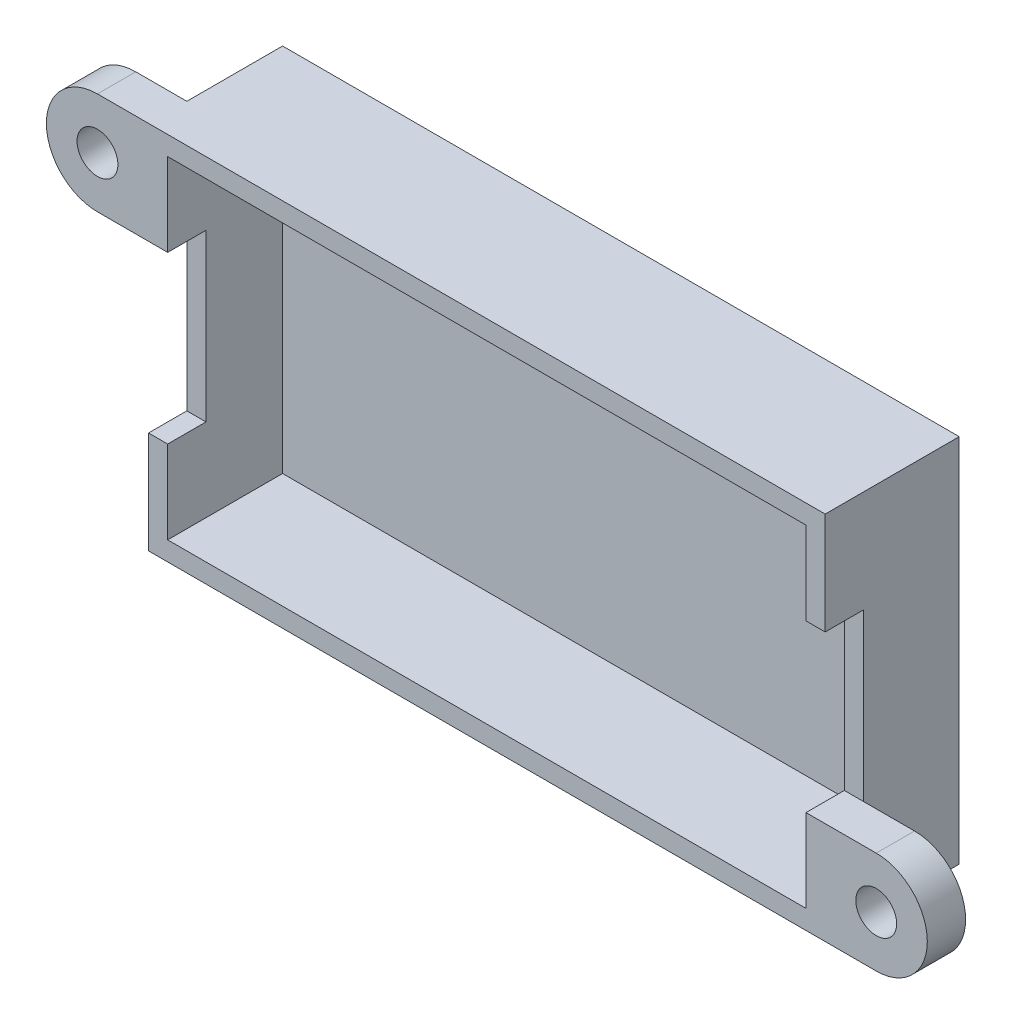
from build123d import *

# Parameters (mm, degrees)
SKETCH_1_W          = 53
SKETCH_1_H          = 29
EXTRUDE_1_DEPTH     = 10.5
SHELL_1_T           = -1.5
SKETCH_3_R          = 1.6
EXTRUDE_2_DEPTH     = 3
SKETCH_4_W          = 3
SKETCH_4_H          = 13
CUT_EXTRUDE_1_DEPTH = 53


with BuildPart() as part:
    # 草图1 → 凸台-拉伸1 (new body)
    with BuildSketch(Plane.XY):
        Rectangle(SKETCH_1_W, SKETCH_1_H)
    extrude(amount=EXTRUDE_1_DEPTH)

    # 抽壳1
    shell_1_openings = [part.faces().sort_by_distance(p)[0] for p in [
        (0, 0, 10.5),
    ]]
    offset(amount=SHELL_1_T, openings=shell_1_openings, kind=Kind.INTERSECTION)

    # 草图3 → 凸台-拉伸2 (add)
    # profile 1 of 2: a face of its own
    with BuildSketch(Plane.XY.offset(10.5)):
        with BuildLine():
            Line((-26.5, 6.5), (-30.5, 6.5))
            ThreePointArc((-30.5, 6.5), (-34.5, 10.5), (-30.5, 14.5))
            Line((-30.5, 14.5), (-26.5, 14.5))
            Line((-26.5, 14.5), (-26.5, 6.5))
        make_face()
        with Locations((-30.5, 10.5)):
            Circle(SKETCH_3_R, mode=Mode.SUBTRACT)
    # profile 2 of 2: a face of its own
    with BuildSketch(Plane.XY.offset(10.5)):
        with BuildLine():
            Line((26.5, -6.5), (30.5, -6.5))
            ThreePointArc((30.5, -6.5), (34.5, -10.5), (30.5, -14.5))
            Line((30.5, -14.5), (26.5, -14.5))
            Line((26.5, -14.5), (26.5, -6.5))
        make_face()
        with Locations((30.5, -10.5)):
            Circle(SKETCH_3_R, mode=Mode.SUBTRACT)
    extrude(amount=-EXTRUDE_2_DEPTH)

    # 草图4 → 切除-拉伸1 (cut)
    with BuildSketch(Plane.ZY.offset(26.5)):
        with Locations((9, 0)):
            Rectangle(SKETCH_4_W, SKETCH_4_H)
    extrude(amount=-CUT_EXTRUDE_1_DEPTH, mode=Mode.SUBTRACT)


solid = part.part
